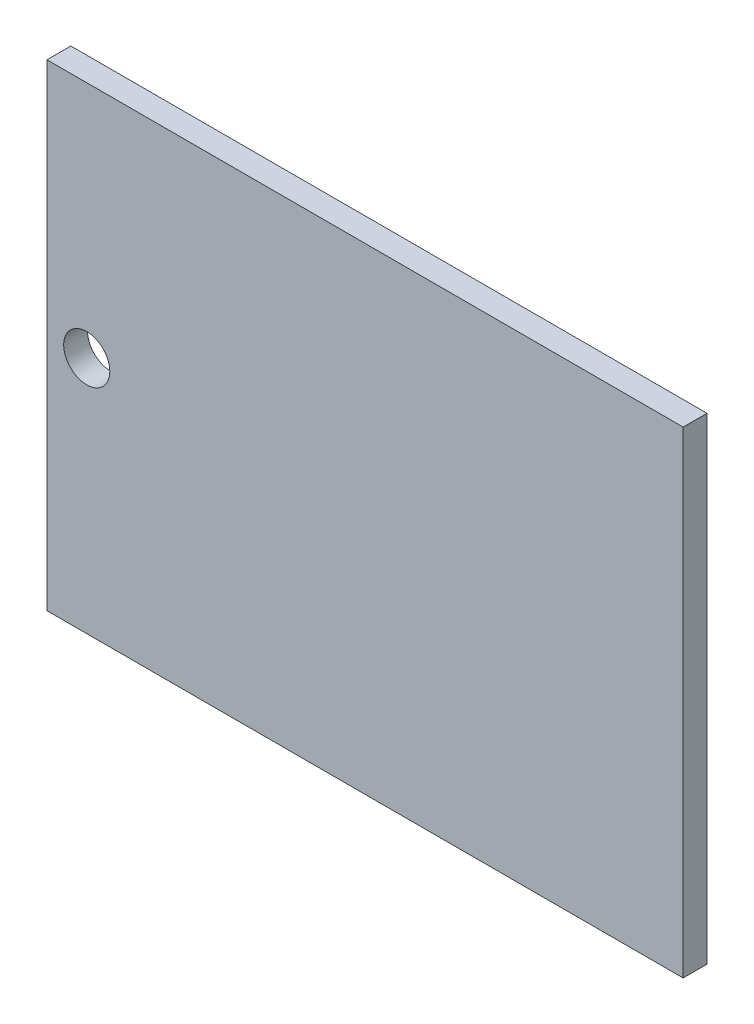
from build123d import *

# Parameters (mm, degrees)
SKETCH1_W           = 40
SKETCH1_H           = 30
BOSS_EXTRUDE2_DEPTH = 1.5
SKETCH2_R           = 1.45
CUT_EXTRUDE1_DEPTH  = 26.044959573


with BuildPart() as part:
    # Sketch1 → Boss-Extrude2 (new body)
    with BuildSketch(Plane.XY):
        Rectangle(SKETCH1_W, SKETCH1_H)
    extrude(amount=BOSS_EXTRUDE2_DEPTH)

    # Sketch2 → Cut-Extrude1 (cut, through all)
    with BuildSketch(Plane.XY.offset(1.5)):
        with Locations((-17.5, 0)):
            Circle(SKETCH2_R)
    extrude(amount=-CUT_EXTRUDE1_DEPTH, mode=Mode.SUBTRACT)


solid = part.part
